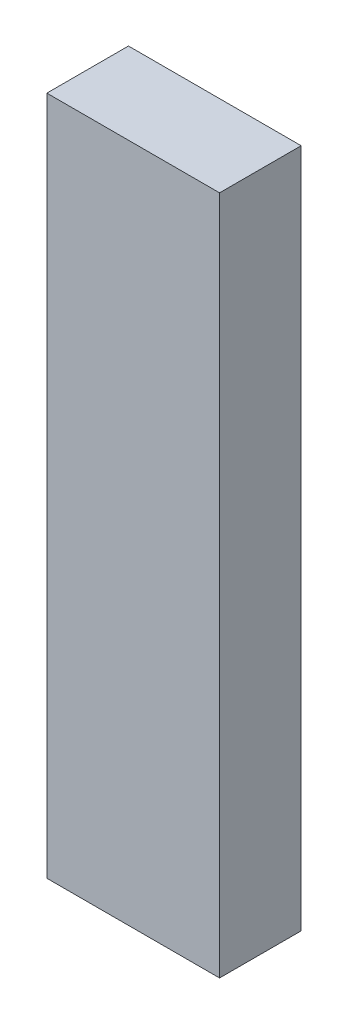
from build123d import *

# Parameters (mm, degrees)
SKETCH1_W           = 6.35
SKETCH1_H           = 25
BOSS_EXTRUDE1_DEPTH = 3


with BuildPart() as part:
    # Sketch1 → Boss-Extrude1 (new body)
    with BuildSketch(Plane.XY):
        Rectangle(SKETCH1_W, SKETCH1_H)
    extrude(amount=BOSS_EXTRUDE1_DEPTH)


solid = part.part
